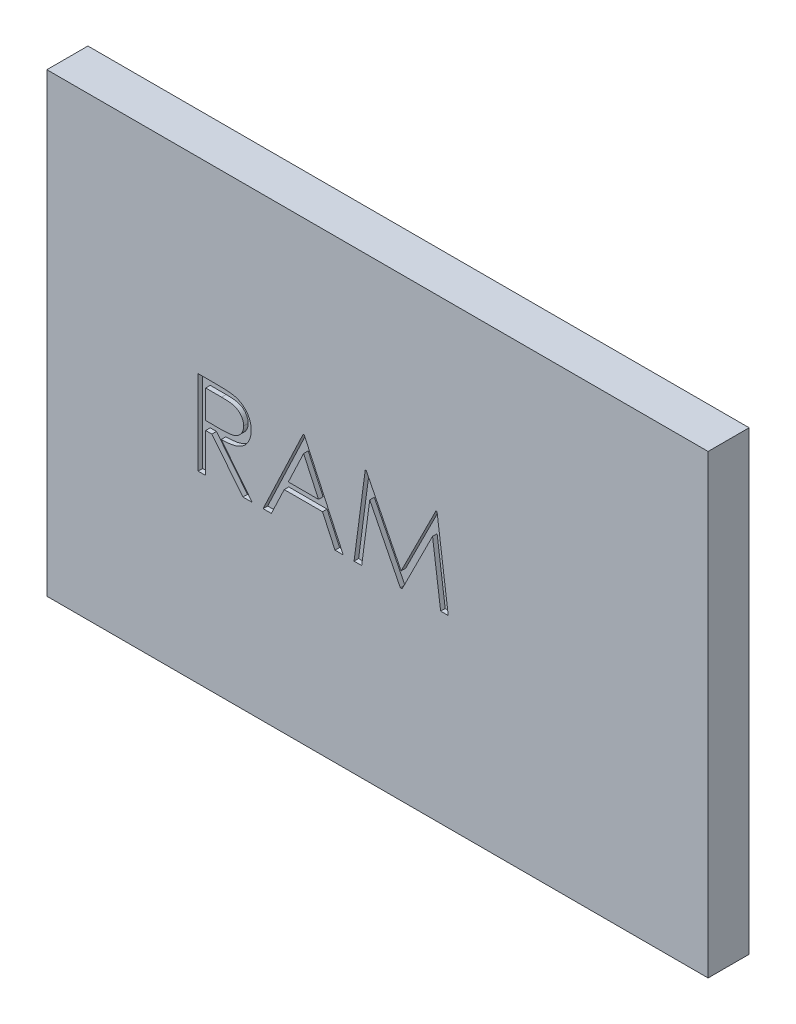
from build123d import *

# Parameters (mm, degrees)
ESQUISSE1_W             = 14.5
ESQUISSE1_H             = 10
BOSS_EXTRU_1_DEPTH      = 0.9
ENL_V_MAT_EXTRU_1_DEPTH = 0.1


with BuildPart() as part:
    # Esquisse1 → Boss.-Extru.1 (new body)
    with BuildSketch(Plane.XY):
        Rectangle(ESQUISSE1_W, ESQUISSE1_H)
    extrude(amount=BOSS_EXTRU_1_DEPTH)

    # Esquisse2 → Enlèv. mat.-Extru.1 (cut)
    # profile 1 of 3: a face of its own
    with BuildSketch(Plane.XY.offset(0.9)):
        with BuildLine():
            Line((-3.93297689, 0.88662019), (-3.562337617, 0.88662019))
            add(Edge.make_bspline(
                [(-3.562337617, 0.88662019), (-3.53760377, 0.886537859), (-3.490112043, 0.886379775), (-3.422075354, 0.885498308), (-3.360254349, 0.882971879), (-3.304681351, 0.880797753), (-3.255357379, 0.876833268), (-3.212131188, 0.873044092), (-3.175201864, 0.868083863), (-3.152846768, 0.863477243), (-3.142724987, 0.861391491)],
                knots=[0, 0, 0, 0, 1.410062039, 2.707475311, 3.878576406, 4.937260626, 5.877586885, 6.699081471, 7.410979367, 8, 8, 8, 8], degree=3))
            add(Edge.make_bspline(
                [(-3.142724987, 0.861391491), (-3.129174815, 0.858043577), (-3.102363533, 0.851419171), (-3.06376079, 0.837417632), (-3.026976127, 0.821214747), (-2.992162344, 0.802183945), (-2.959493822, 0.780183958), (-2.928633716, 0.755594576), (-2.899441991, 0.728550347), (-2.873099212, 0.69836941), (-2.84826063, 0.666705923), (-2.827311649, 0.632466852), (-2.809253053, 0.596662627), (-2.794875321, 0.558929118), (-2.783298227, 0.519632264), (-2.775135175, 0.478416109), (-2.770239755, 0.435468427), (-2.769741357, 0.406174867), (-2.769488642, 0.391321462)],
                knots=[0, 0, 0, 0, 1.027469482, 2.033020251, 3.019912614, 3.986113645, 4.951240523, 5.91722682, 6.890402269, 7.87763091, 8.8651537, 9.85103654, 10.82876324, 11.815024772, 12.821070561, 13.842952187, 14.906261191, 16, 16, 16, 16], degree=3))
            add(Edge.make_bspline(
                [(-2.769488642, 0.391321462), (-2.770265987, 0.366643719), (-2.771782788, 0.318491051), (-2.785924822, 0.248608835), (-2.809089897, 0.183421156), (-2.841010971, 0.123010093), (-2.881661277, 0.06855321), (-2.930516479, 0.020721594), (-2.987603831, -0.019304526), (-3.040747678, -0.047060802), (-3.087692275, -0.06483705), (-3.12633907, -0.077344623), (-3.168496179, -0.087008246), (-3.213759685, -0.095665482), (-3.262317953, -0.102201587), (-3.314054598, -0.106988744), (-3.36900652, -0.109980678), (-3.406756778, -0.110426239), (-3.426176843, -0.110655451)],
                knots=[0, 0, 0, 0, 1.260483769, 2.459530307, 3.627416485, 4.787058657, 5.939039949, 7.08810263, 8.267026773, 9.491475466, 10.141966685, 10.831826277, 11.566392101, 12.351337768, 13.187381173, 14.07005841, 15.007169909, 16, 16, 16, 16], degree=3))
            Line((-3.426176843, -0.110655451), (-2.745743984, -0.965463143))
            Line((-2.745743984, -0.965463143), (-2.951283681, -0.965463143))
            Line((-2.951283681, -0.965463143), (-3.63171654, -0.110655451))
            Line((-3.63171654, -0.110655451), (-3.766764283, -0.110655451))
            Line((-3.766764283, -0.110655451), (-3.766764283, -0.965463143))
            Line((-3.766764283, -0.965463143), (-3.93297689, -0.965463143))
            Line((-3.93297689, -0.965463143), (-3.93297689, 0.88662019))
        make_face()
        with BuildLine():
            Line((-3.766764283, 0.696662925), (-3.766764283, 0.079301814))
            Line((-3.766764283, 0.079301814), (-3.427660884, 0.076704742))
            add(Edge.make_bspline(
                [(-3.427660884, 0.076704742), (-3.411828197, 0.076697738), (-3.38113994, 0.076684161), (-3.336742505, 0.078797534), (-3.295403945, 0.081201707), (-3.257282381, 0.084879069), (-3.22236078, 0.089618324), (-3.190656599, 0.095546569), (-3.162118084, 0.102453286), (-3.128834274, 0.113143313), (-3.091667443, 0.130079831), (-3.051275379, 0.154720741), (-3.016878309, 0.185713566), (-2.987817607, 0.221153687), (-2.964465782, 0.260119535), (-2.94800232, 0.30214403), (-2.937555278, 0.346166251), (-2.936323089, 0.376423), (-2.935701249, 0.391692472)],
                knots=[0, 0, 0, 0, 1.146690395, 2.22261258, 3.21895312, 4.145990853, 4.996080663, 5.770904154, 6.481378293, 7.121626537, 8.300444488, 9.431385265, 10.535395872, 11.636531494, 12.74115979, 13.810798291, 14.895190096, 16, 16, 16, 16], degree=3))
            add(Edge.make_bspline(
                [(-2.935701249, 0.391692472), (-2.936337371, 0.406586701), (-2.937597934, 0.436101627), (-2.947889574, 0.479311213), (-2.965293538, 0.520092474), (-2.988747389, 0.558279514), (-3.017321942, 0.592942966), (-3.050827618, 0.622601251), (-3.088348283, 0.647074926), (-3.123416793, 0.662714119), (-3.154761563, 0.672302542), (-3.181976425, 0.679050033), (-3.212727082, 0.684471064), (-3.247162846, 0.688814496), (-3.285136709, 0.692547738), (-3.326840678, 0.69506222), (-3.371998058, 0.696551224), (-3.403296642, 0.696624825), (-3.419498658, 0.696662925)],
                knots=[0, 0, 0, 0, 1.101028733, 2.181837193, 3.264309656, 4.369019818, 5.486613113, 6.575447106, 7.666700264, 8.788928104, 9.402425223, 10.0903467, 10.862060571, 11.710948788, 12.657782767, 13.684531032, 14.801375019, 16, 16, 16, 16], degree=3))
            Line((-3.419498658, 0.696662925), (-3.766764283, 0.696662925))
        make_face(mode=Mode.SUBTRACT)
    # profile 2 of 3: a face of its own
    with BuildSketch(Plane.XY.offset(0.9)):
        Polygon((-1.606000394, 0.88662019), (-0.751192702, -0.965463143), (-0.93187471, -0.965463143), (-1.205680299, -0.37184669), (-2.045276569, -0.37184669), (-2.326873374, -0.965463143), (-2.508297403, -0.965463143), (-1.629745052, 0.88662019), align=None)
        Polygon((-1.619727775, 0.525627185), (-1.955121071, -0.181889425), (-1.293238725, -0.181889425), align=None, mode=Mode.SUBTRACT)
    # profile 3 of 3: a face of its own
    with BuildSketch(Plane.XY.offset(0.9)):
        Polygon((-0.513746121, -0.965463143), (-0.269250344, 0.88662019), (-0.245505686, 0.88662019), (0.519146508, -0.63303793), (1.28194365, 0.88662019), (1.306059318, 0.88662019), (1.552039136, -0.965463143), (1.385084508, -0.965463143), (1.207741593, 0.367205794), (0.539181063, -0.965463143), (0.501709024, -0.965463143), (-0.169448578, 0.370173876), (-0.346420483, -0.965463143), align=None)
    extrude(amount=-ENL_V_MAT_EXTRU_1_DEPTH, mode=Mode.SUBTRACT)


solid = part.part
